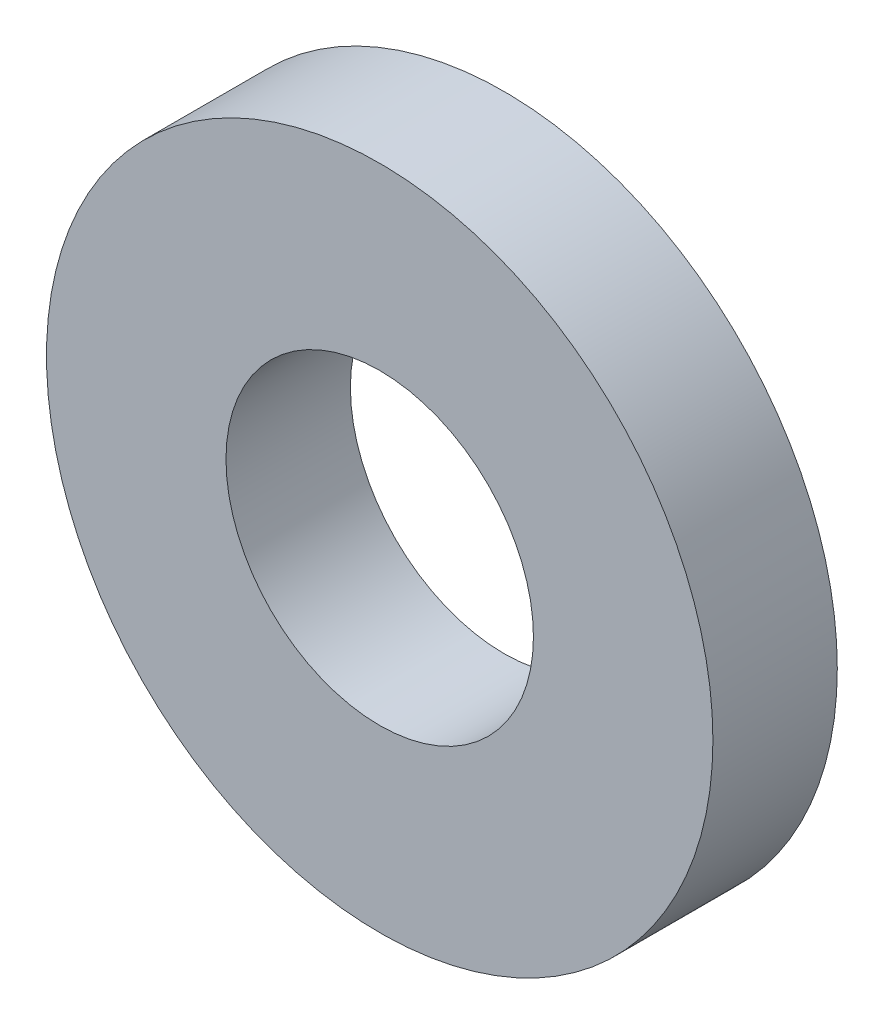
from build123d import *

# Parameters (mm, degrees)
BOSS_EXTRUDE1_DEPTH      = 0.889
BOSS_EXTRUDE1_DEPTH_BACK = 0.889
SKETCH3_R                = 4.7625
SKETCH3_R_2              = 2.1971


with BuildPart() as part:
    # Sketch3 → Boss-Extrude1 (new, two sides: drawn at the far end of the back side and taken through both)
    with BuildSketch(Plane.XY.offset(-BOSS_EXTRUDE1_DEPTH_BACK)):
        Circle(SKETCH3_R)
        Circle(SKETCH3_R_2, mode=Mode.SUBTRACT)
    extrude(amount=BOSS_EXTRUDE1_DEPTH + BOSS_EXTRUDE1_DEPTH_BACK)


solid = part.part
